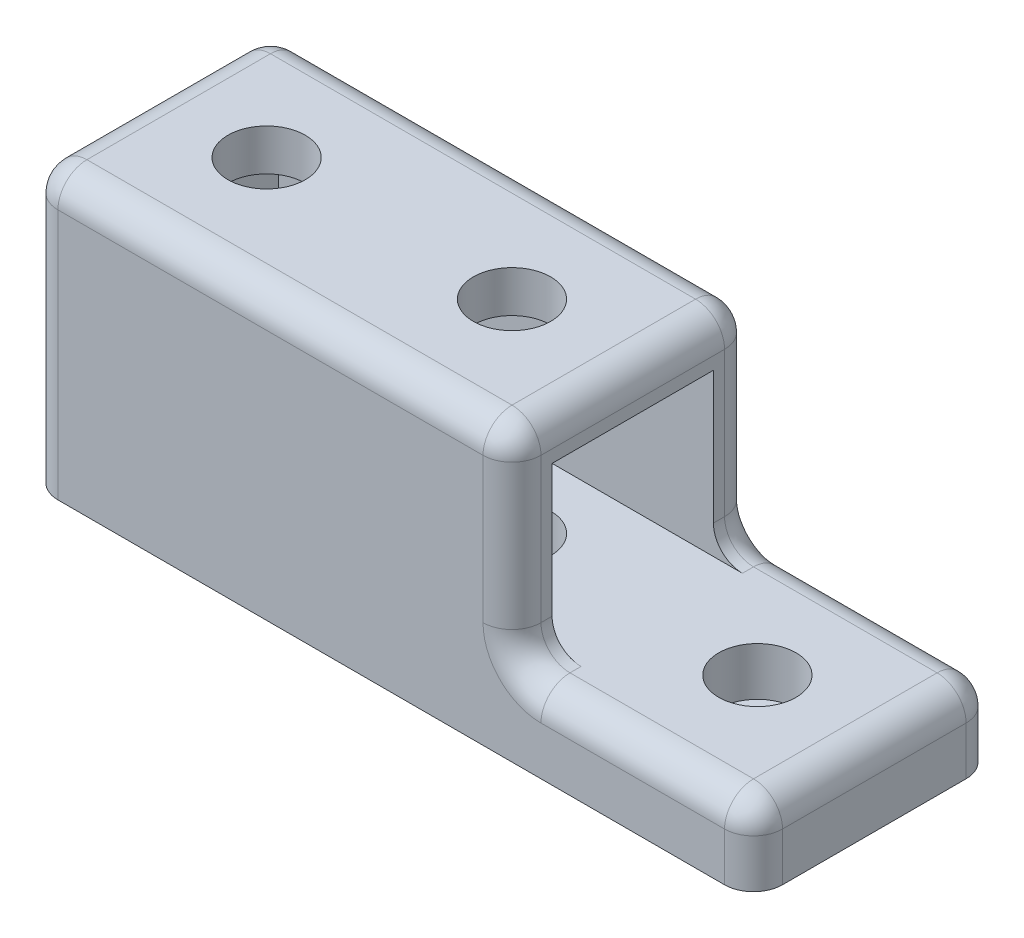
from build123d import *

# Parameters (mm, degrees)
SKETCH1_W               = 75
SKETCH1_H               = 25
BOSS_EXTRUDE1_DEPTH     = 8
SKETCH5_W               = 25
SKETCH5_H               = 21
BOSS_EXTRUDE2_DEPTH     = 50
SKETCH7_W               = 16.7
SKETCH7_H               = 16.7
CUT_EXTRUDE3_DEPTH      = 45
SKETCH4_R               = 2.38125
CUT_EXTRUDE2_DEPTH      = 50.025503567
CUT_EXTRUDE1_DEPTH      = 45.760473635
CUT_EXTRUDE1_DEPTH_BACK = 5
SKETCH3_R               = 4
FILLET1_R               = 3
SKETCH8_R               = 3.175
CUT_EXTRUDE4_DEPTH      = 77.793554417


with BuildPart() as part:
    # Sketch1 → Boss-Extrude1 (new body)
    with BuildSketch(Plane(origin=(0, 0, 0), x_dir=(1, 0, 0), z_dir=(0, 1, 0))):
        Rectangle(SKETCH1_W, SKETCH1_H)
    extrude(amount=BOSS_EXTRUDE1_DEPTH)

    # Sketch5 → Boss-Extrude2 (add)
    with BuildSketch(Plane.ZY.offset(37.5)):
        with Locations((0, 18.5)):
            Rectangle(SKETCH5_W, SKETCH5_H)
    extrude(amount=-BOSS_EXTRUDE2_DEPTH)

    # Sketch7 → Cut-Extrude3 (cut)
    with BuildSketch(Plane(origin=(12.5, 0, 0), x_dir=(0, 0, -1), z_dir=(1, 0, 0))):
        with Locations((0, 16.35)):
            Rectangle(SKETCH7_W, SKETCH7_H)
    extrude(amount=-CUT_EXTRUDE3_DEPTH, mode=Mode.SUBTRACT)

    # Sketch4 → Cut-Extrude2 (cut, through all)
    with BuildSketch(Plane(origin=(0, 0, 0), x_dir=(1, 0, 0), z_dir=(0, 1, 0))):
        with Locations(Location((0, 0, 0), (0, 0, 90))):
            Circle(SKETCH4_R)
        with Locations(Location((25.4, 0, 0), (0, 0, 90))):
            Circle(SKETCH4_R)
        with Locations(Location((-25.4, 0, 0), (0, 0, 90))):
            Circle(SKETCH4_R)
    extrude(amount=CUT_EXTRUDE2_DEPTH, mode=Mode.SUBTRACT)

    # Sketch3 → Cut-Extrude1 (cut, two sides: drawn at the far end of the back side and taken through both)
    with BuildSketch(Plane(origin=(0, 8, 0), x_dir=(1, 0, 0), z_dir=(0, 1, 0)).offset(-CUT_EXTRUDE1_DEPTH_BACK)):
        with Locations(Location((0, 0, 0), (0, 0, 90))):
            Circle(SKETCH3_R)
        with Locations(Location((25.4, 0, 0), (0, 0, 90))):
            Circle(SKETCH3_R)
        with Locations(Location((-25.4, 0, 0), (0, 0, 90))):
            Circle(SKETCH3_R)
    extrude(amount=CUT_EXTRUDE1_DEPTH + CUT_EXTRUDE1_DEPTH_BACK, mode=Mode.SUBTRACT)

    # Fillet1
    fillet1_edges = [part.edges().sort_by_distance(p)[0] for p in [
        (25, 8, 12.5),
        (12.5, 18.5, -12.5),
        (12.5, 29, 0),
        (-12.5, 29, -12.5),
        (12.5, 18.5, 12.5),
        (-12.5, 29, 12.5),
        (12.5, 8, -10.425),
        (-37.5, 29, 0),
        (12.5, 8, 10.425),
        (37.5, 8, 0),
        (37.5, 4, 12.5),
        (-37.5, 14.5, 12.5),
        (-37.5, 14.5, -12.5),
        (37.5, 4, -12.5),
        (25, 8, -12.5),
    ]]
    fillet(fillet1_edges, radius=FILLET1_R)

    # Sketch8 → Cut-Extrude4 (cut, through all)
    with BuildSketch(Plane(origin=(-32.5, 0, 0), x_dir=(0, 0, -1), z_dir=(1, 0, 0))):
        with Locations((0, 16.35)):
            Circle(SKETCH8_R)
    extrude(amount=-CUT_EXTRUDE4_DEPTH, mode=Mode.SUBTRACT)


solid = part.part
